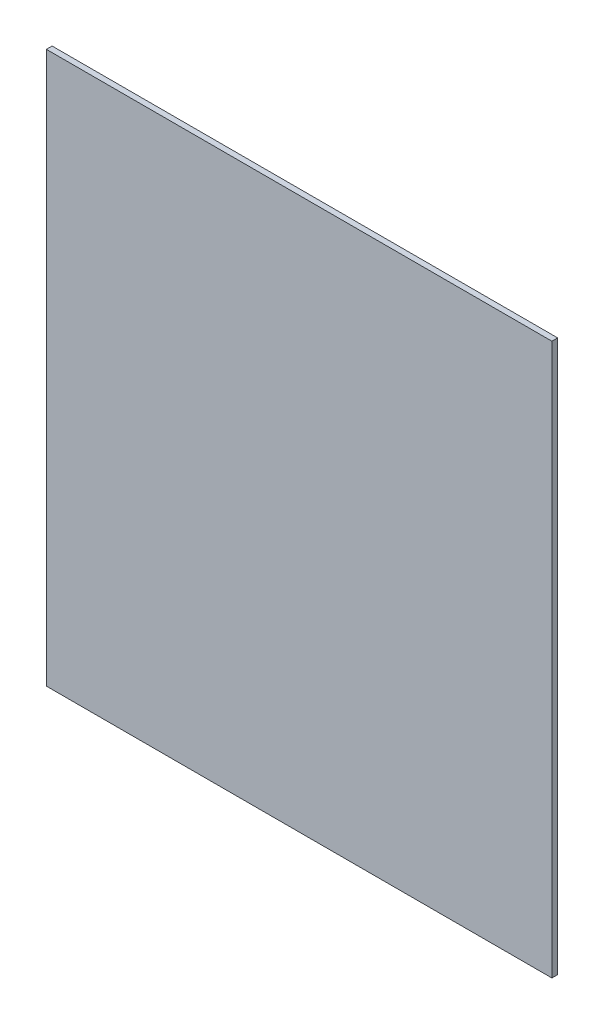
from build123d import *

# Parameters (mm, degrees)
SKETCH1_W           = 279.4
SKETCH1_H           = 304.8
BOSS_EXTRUDE1_DEPTH = 3.175


with BuildPart() as part:
    # Sketch1 → Boss-Extrude1 (new body)
    with BuildSketch(Plane.XY):
        with Locations((-139.7, -152.4)):
            Rectangle(SKETCH1_W, SKETCH1_H)
    extrude(amount=BOSS_EXTRUDE1_DEPTH)


solid = part.part
